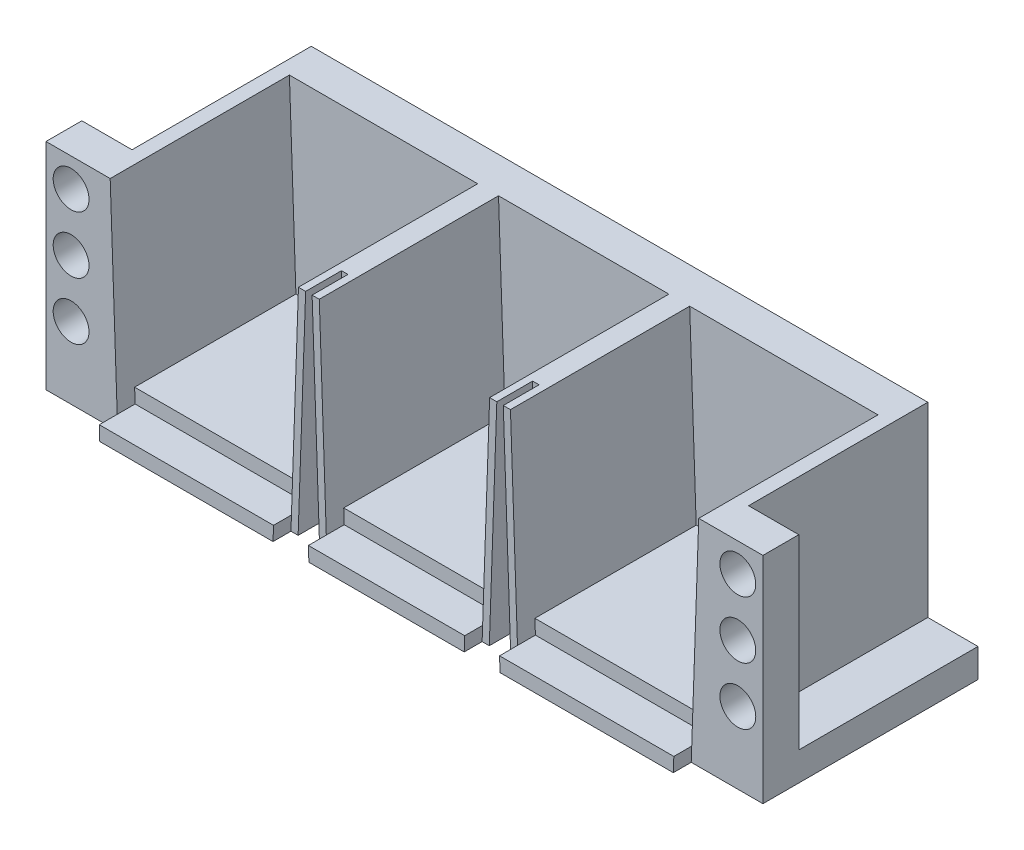
from build123d import *

# Parameters (mm, degrees)
SKETCH3_W           = 100
SKETCH3_H           = 30
BOSS_EXTRUDE1_DEPTH = 30
SKETCH3_6_R         = 2.5
CUT_EXTRUDE1_DEPTH  = 25
CUT_EXTRUDE2_DEPTH  = 5
CUT_EXTRUDE3_START  = -5
SKETCH3_9_W         = 7
SKETCH3_9_H         = 26
CUT_EXTRUDE3_DEPTH  = 104.627804912
CUT_EXTRUDE4_DEPTH  = 2.5
BOSS_EXTRUDE2_DEPTH = 2.5


with BuildPart() as part:
    # Sketch3 → Boss-Extrude1 (new body)
    with BuildSketch(Plane.XY):
        with Locations((50, -15)):
            Rectangle(SKETCH3_W, SKETCH3_H)
    extrude(amount=-BOSS_EXTRUDE1_DEPTH)

    # Sketch3<6> → Cut-Extrude1 (cut)
    with BuildSketch(Plane.XY):
        Polygon((35.214289751, 0), (8.952376915, 0), (9.860316922, -26), (34.306349745, -26), align=None)
        Polygon((61.880956418, 0), (38.119043582, 0), (39.026983589, -26), (60.973016411, -26), align=None)
        Polygon((91.047623085, 0), (64.785710249, 0), (65.693650255, -26), (90.139683078, -26), align=None)
        with Locations((3.5, -4)):
            Circle(SKETCH3_6_R)
        with Locations((3.5, -12)):
            Circle(SKETCH3_6_R)
        with Locations((3.5, -20)):
            Circle(SKETCH3_6_R)
        with Locations((96.5, -4)):
            Circle(SKETCH3_6_R)
        with Locations((96.5, -12)):
            Circle(SKETCH3_6_R)
        with Locations((96.5, -20)):
            Circle(SKETCH3_6_R)
    extrude(amount=-CUT_EXTRUDE1_DEPTH, mode=Mode.SUBTRACT)

    # Sketch3<8> → Cut-Extrude2 (cut)
    with BuildSketch(Plane.XY):
        Polygon((37.118434038, 0), (36.214899296, 0), (35.167276211, -30), (38.166057122, -30), align=None)
        Polygon((63.785100704, 0), (62.881565962, 0), (61.833942878, -30), (64.832723789, -30), align=None)
    extrude(amount=-CUT_EXTRUDE2_DEPTH, mode=Mode.SUBTRACT)

    # Sketch3<9> → Cut-Extrude3 (cut, through all)
    with BuildSketch(Plane.XY.offset(CUT_EXTRUDE3_START)):
        with Locations((3.5, -13)):
            Rectangle(SKETCH3_9_W, SKETCH3_9_H)
        with Locations((96.5, -13)):
            Rectangle(SKETCH3_9_W, SKETCH3_9_H)
    extrude(amount=-CUT_EXTRUDE3_DEPTH, mode=Mode.SUBTRACT)

    # Sketch3<10> → Cut-Extrude4 (cut)
    with BuildSketch(Plane.XY):
        Polygon((34.306349745, -26), (9.860316922, -26), (9.930158461, -28), (34.236508206, -28), align=None)
        Polygon((60.973016411, -26), (39.026983589, -26), (39.096825128, -28), (60.903174872, -28), align=None)
        Polygon((90.139683078, -26), (65.693650255, -26), (65.763491794, -28), (90.069841539, -28), align=None)
    extrude(amount=-CUT_EXTRUDE4_DEPTH, mode=Mode.SUBTRACT)

    # Sketch3<11> → Boss-Extrude2 (add)
    with BuildSketch(Plane.XY):
        Polygon((34.236508206, -28), (9.930158461, -28), (10, -30), (34.166666667, -30), align=None)
        Polygon((60.903174872, -28), (39.096825128, -28), (39.166666667, -30), (60.833333333, -30), align=None)
        Polygon((90.069841539, -28), (65.763491794, -28), (65.833333333, -30), (90, -30), align=None)
    extrude(amount=BOSS_EXTRUDE2_DEPTH)


solid = part.part
